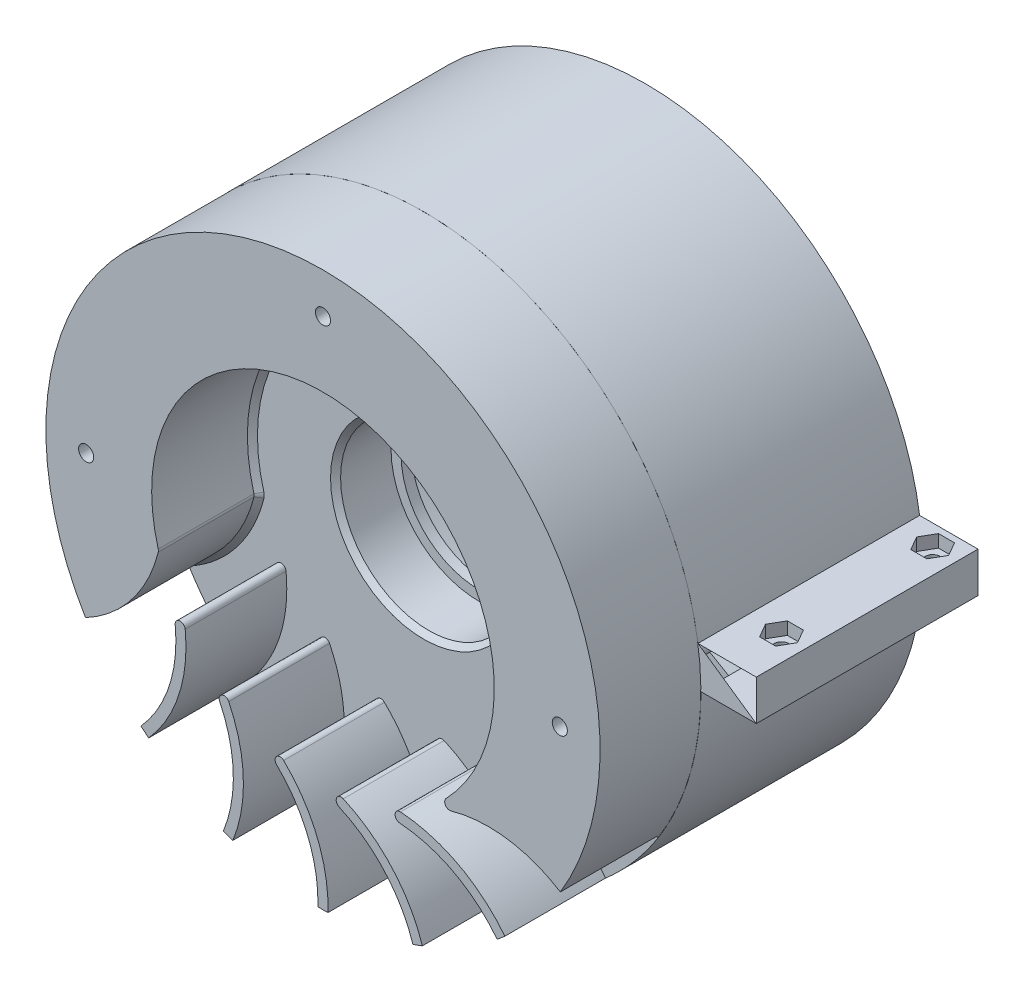
from build123d import *

# Parameters (mm, degrees)
EXTRUDE_1_DEPTH          = 20
SKETCH_1_W               = 44
SKETCH_1_H               = 37.5
PATTERN_CIRCULAR_1_COUNT = 7
PATTERN_CIRCULAR_1_ANGLE = 120
EXTRUDE_2_DEPTH          = 20
SKETCH_4_R               = 17.5
SKETCH_4_R_2             = 1.5
CUT_EXTRUDE_1_DEPTH      = 33
SKETCH_5_R               = 1.5
CUT_EXTRUDE_2_DEPTH      = 31
SKETCH_7_R               = 19.5
SKETCH_7_R_2             = 15.5
EXTRUDE_3_DEPTH          = 2
CHAMFER_2_SIZE           = 1
CHAMFER_3_SIZE           = 1
SKETCH_9_W               = 11
SKETCH_9_H               = 44
EXTRUDE_4_DEPTH          = 8
EXTRUDE_4_2_DEPTH        = 8
EXTRUDE_6_REACH          = 142.007
EXTRUDE_6_END_RADIUS     = 55
SKETCH_12_W              = 44
SKETCH_12_H              = 8
SKETCH_14_R              = 1.5
CUT_EXTRUDE_3_DEPTH      = 8
EXTRUDE_7_REACH          = 142.007
EXTRUDE_7_END_RADIUS     = 55
SKETCH_15_W              = 44
SKETCH_15_H              = 8
CUT_EXTRUDE_START        = -8
CUT_EXTRUDE_4_DEPTH      = 2.5


with BuildPart() as part:
    # 草图2 → 凸台-拉伸1 (new body)
    with BuildSketch(Plane.XY):
        with BuildLine():
            ThreePointArc((-47.128274794, -28.344764849), (-47.636192587, -27.482596951), (-48.12833958, -26.611330456))
            ThreePointArc((-48.12833958, -26.611330456), (-47.694667466, -26.376608419), (-47.265371804, -26.133974596))
            ThreePointArc((-47.265371804, -26.133974596), (-39.241284875, -19.038172947), (-34.623149334, -9.373329637))
            ThreePointArc((-34.623149334, -9.373329637), (-33.41025778, -8.646078594), (-32.683006737, -9.858970147))
            ThreePointArc((-32.683006737, -9.858970147), (-37.644571288, -20.242542376), (-46.265371804, -27.866025404))
            ThreePointArc((-46.265371804, -27.866025404), (-46.694779385, -28.109079174), (-47.128274794, -28.344764849))
        make_face()
    extrude_1 = extrude(amount=EXTRUDE_1_DEPTH)

    # 草图1 → 旋转1 (revolve)
    with BuildSketch(Plane(origin=(0, 0, 0), x_dir=(0, 0, -1), z_dir=(1, 0, 0)), mode=Mode.PRIVATE) as revolve_1_sk:
        with Locations((22, 36.25)):
            Rectangle(SKETCH_1_W, SKETCH_1_H)
    revolve(revolve_1_sk.sketch.rotate(Axis((0, 0, 0), (0, 0, -1)), 90), axis=Axis((0, 0, 0), (0, 0, -1)))

    # 阵列(圆周)1: 凸台-拉伸1 ×7 about axis
    pattern_circular_1_axis = Axis((0, 0, 0), (0, 0, 1))
    for i in range(1, PATTERN_CIRCULAR_1_COUNT):
        add(extrude_1.rotate(pattern_circular_1_axis, i * PATTERN_CIRCULAR_1_ANGLE / (PATTERN_CIRCULAR_1_COUNT - 1)))

    # 草图3 → 凸台-拉伸2 (add)
    with BuildSketch(Plane.XY):
        with BuildLine():
            ThreePointArc((-47.128274794, -28.344764849), (0.017469172, 54.995451395), (47.110257993, -28.37469949))
            ThreePointArc((47.110257993, -28.37469949), (36.597025339, -24.52967003), (25.429116251, -25.297862063))
            ThreePointArc((25.429116251, -25.297862063), (24.296725269, -24.850589692), (24.435672851, -23.641021389))
            ThreePointArc((24.435672851, -23.641021389), (8.255888669, 32.982424142), (-32.69156152, -9.341402752))
            ThreePointArc((-32.69156152, -9.341402752), (-32.653214608, -9.599623321), (-32.683006737, -9.858970147))
            ThreePointArc((-32.683006737, -9.858970147), (-37.945055609, -20.633918382), (-47.128274794, -28.344764849))
        make_face()
    extrude(amount=EXTRUDE_2_DEPTH)

    # 草图4 → 切除-拉伸1 (cut)
    # profile 1 of 5: a face of its own
    with BuildSketch(Plane(origin=(0, 0, -44), x_dir=(-1, 0, 0), z_dir=(0, 0, -1))):
        with BuildLine():
            Line((-49.686269666, 5.592370399), (-45.25, 3.031088913))
            ThreePointArc((-45.25, 3.031088913), (-43.5, 0), (-45.25, -3.031088913))
            Line((-45.25, -3.031088913), (-49.686269666, -5.592370399))
            ThreePointArc((-49.686269666, -5.592370399), (-45.049721192, -21.691533383), (-35.355339059, -35.355339059))
            ThreePointArc((-35.355339059, -35.355339059), (-33.319524907, -37.280145654), (-31.179095181, -39.087901245))
            ThreePointArc((-31.179095181, -39.087901245), (-19.134171618, -46.193976626), (-5.592370399, -49.686269666))
            Line((-5.592370399, -49.686269666), (-3.031088913, -45.25))
            ThreePointArc((-3.031088913, -45.25), (0, -43.5), (3.031088913, -45.25))
            Line((3.031088913, -45.25), (5.592370399, -49.686269666))
            ThreePointArc((5.592370399, -49.686269666), (21.691533383, -45.049721192), (35.355339059, -35.355339059))
            ThreePointArc((35.355339059, -35.355339059), (37.280145654, -33.319524907), (39.087901245, -31.179095181))
            ThreePointArc((39.087901245, -31.179095181), (46.193976626, -19.134171618), (49.686269666, -5.592370399))
            Line((49.686269666, -5.592370399), (45.25, -3.031088913))
            ThreePointArc((45.25, -3.031088913), (43.5, 0), (45.25, 3.031088913))
            Line((45.25, 3.031088913), (49.686269666, 5.592370399))
            ThreePointArc((49.686269666, 5.592370399), (45.049721192, 21.691533383), (35.355339059, 35.355339059))
            ThreePointArc((35.355339059, 35.355339059), (33.319524907, 37.280145654), (31.179095181, 39.087901245))
            ThreePointArc((31.179095181, 39.087901245), (19.134171618, 46.193976626), (5.592370399, 49.686269666))
            Line((5.592370399, 49.686269666), (3.031088913, 45.25))
            ThreePointArc((3.031088913, 45.25), (0, 43.5), (-3.031088913, 45.25))
            Line((-3.031088913, 45.25), (-5.592370399, 49.686269666))
            ThreePointArc((-5.592370399, 49.686269666), (-21.691533383, 45.049721192), (-35.355339059, 35.355339059))
            ThreePointArc((-35.355339059, 35.355339059), (-37.280145654, 33.319524907), (-39.087901245, 31.179095181))
            ThreePointArc((-39.087901245, 31.179095181), (-46.193976626, 19.134171618), (-49.686269666, 5.592370399))
        make_face()
        with Locations(Location((0, 0, 0), (0, 0, 180))):
            Circle(SKETCH_4_R, mode=Mode.SUBTRACT)
    # profile 2 of 5: a face of its own
    with BuildSketch(Plane(origin=(0, 0, -44), x_dir=(-1, 0, 0), z_dir=(0, 0, -1))):
        with Locations((0, 47)):
            Circle(SKETCH_4_R_2)
    # profile 3 of 5: a face of its own
    with BuildSketch(Plane(origin=(0, 0, -44), x_dir=(-1, 0, 0), z_dir=(0, 0, -1))):
        with Locations((47, 0)):
            Circle(SKETCH_4_R_2)
    # profile 4 of 5: a face of its own
    with BuildSketch(Plane(origin=(0, 0, -44), x_dir=(-1, 0, 0), z_dir=(0, 0, -1))):
        with Locations((0, -47)):
            Circle(SKETCH_4_R_2)
    # profile 5 of 5: a face of its own
    with BuildSketch(Plane(origin=(0, 0, -44), x_dir=(-1, 0, 0), z_dir=(0, 0, -1))):
        with Locations((-47, 0)):
            Circle(SKETCH_4_R_2)
    extrude(amount=-CUT_EXTRUDE_1_DEPTH, mode=Mode.SUBTRACT)

    # 草图5 → 切除-拉伸2 (cut)
    with BuildSketch(Plane(origin=(0, 0, -11), x_dir=(-1, 0, 0), z_dir=(0, 0, -1))):
        with Locations((0, 47)):
            Circle(SKETCH_5_R)
        with Locations((-47, 0)):
            Circle(SKETCH_5_R)
        with Locations((47, 0)):
            Circle(SKETCH_5_R)
    extrude(amount=-CUT_EXTRUDE_2_DEPTH, mode=Mode.SUBTRACT)

    # 草图7 → 凸台-拉伸3 (add)
    with BuildSketch(Plane(origin=(0, 0, -11), x_dir=(-1, 0, 0), z_dir=(0, 0, -1))):
        Circle(SKETCH_7_R)
        Circle(SKETCH_7_R_2, mode=Mode.SUBTRACT)
    extrude(amount=EXTRUDE_3_DEPTH)

    # 倒角2
    chamfer_2_edges = [part.edges().sort_by_distance(p)[0] for p in [
        (-17.5, 0, 0),
    ]]
    chamfer(chamfer_2_edges, length=CHAMFER_2_SIZE)

    # 倒角3
    chamfer_3_edges = [part.edges().sort_by_distance(p)[0] for p in [
        (24.296725269, -24.850589692, 0),
        (8.255888669, 32.982424142, 0),
        (-32.653214608, -9.599623321, 0),
        (-37.945055609, -20.633918382, 0),
        (36.597025339, -24.52967003, 0),
    ]]
    chamfer(chamfer_3_edges, length=CHAMFER_3_SIZE)



with BuildPart() as body_2:
    # 草图9 → 凸台-拉伸4 (new body)
    with BuildSketch(Plane(origin=(0, 0, 0), x_dir=(1, 0, 0), z_dir=(0, 1, 0))):
        with Locations((-60.5, 22)):
            Rectangle(SKETCH_9_W, SKETCH_9_H)
    extrude(amount=EXTRUDE_4_DEPTH)


with BuildPart() as body_3:
    # 草图9 → Extrude 4 2 (new body)
    with BuildSketch(Plane(origin=(0, 0, 0), x_dir=(1, 0, 0), z_dir=(0, 1, 0))):
        with Locations((60.5, 22)):
            Rectangle(SKETCH_9_W, SKETCH_9_H)
    extrude(amount=EXTRUDE_4_2_DEPTH)


with BuildPart() as part_1:
    add(part.part)

    add(body_2.part)  # 凸台-拉伸6 merges body 2
    # 凸台-拉伸6: up to this cylinder (the profile starts outside it)
    extrude_6_end = Plane(origin=(0, 0, -22), z_dir=(0, 0, 1)) * Cylinder(EXTRUDE_6_END_RADIUS, 395.014, mode=Mode.PRIVATE)
    # 草图12 → 凸台-拉伸6 (add, up to the surface)
    with BuildSketch(Plane(origin=(-55, 0, 0), x_dir=(0, 0, -1), z_dir=(1, 0, 0)), mode=Mode.PRIVATE) as extrude_6_sk1:
        with Locations((22, 4)):
            Rectangle(SKETCH_12_W, SKETCH_12_H)
    extrude_6_tool1 = extrude(extrude_6_sk1.sketch, amount=EXTRUDE_6_REACH, mode=Mode.PRIVATE) - extrude_6_end
    add(extrude_6_tool1.solids().sort_by_distance((-55, 4, -22))[0])


with BuildPart() as cut_extrude_3_tool:
    # 草图14 → 切除-拉伸3 (new body)
    with BuildSketch(Plane.XZ):
        with Locations(Location((-61, -40, 0), (0, 0, 270))):
            Circle(SKETCH_14_R)
        with Locations(Location((-61, -10, 0), (0, 0, 270))):
            Circle(SKETCH_14_R)
        with Locations(Location((61, -10, 0), (0, 0, 270))):
            Circle(SKETCH_14_R)
        with Locations(Location((61, -40, 0), (0, 0, 270))):
            Circle(SKETCH_14_R)
    extrude(amount=-CUT_EXTRUDE_3_DEPTH)


with BuildPart() as part_2:
    add(part_1.part)

    # 切除-拉伸3: cut by cut_extrude_3_tool
    add(cut_extrude_3_tool.part, mode=Mode.SUBTRACT)



with BuildPart() as body_3_1:
    add(body_3.part)

    # 切除-拉伸3: cut by cut_extrude_3_tool
    add(cut_extrude_3_tool.part, mode=Mode.SUBTRACT)


with BuildPart() as part_3:
    add(part_2.part)

    add(body_3_1.part)  # 凸台-拉伸7 merges body 3
    # 凸台-拉伸7: up to this cylinder (the profile starts outside it)
    extrude_7_end = Plane(origin=(0, 0, -22), z_dir=(0, 0, 1)) * Cylinder(EXTRUDE_7_END_RADIUS, 395.014, mode=Mode.PRIVATE)
    # 草图15 → 凸台-拉伸7 (add, up to the surface)
    with BuildSketch(Plane.ZY.offset(-55), mode=Mode.PRIVATE) as extrude_7_sk1:
        with Locations((-22, 4)):
            Rectangle(SKETCH_15_W, SKETCH_15_H)
    extrude_7_tool1 = extrude(extrude_7_sk1.sketch, amount=EXTRUDE_7_REACH, mode=Mode.PRIVATE) - extrude_7_end
    add(extrude_7_tool1.solids().sort_by_distance((55, 4, -22))[0])

    # 草图17 → 切除-拉伸4 (cut)
    with BuildSketch(Plane.XZ.offset(CUT_EXTRUDE_START)):
        Polygon((-57.824573519, -40), (-59.41228676, -37.25), (-62.58771324, -37.25), (-64.175426481, -40), (-62.58771324, -42.75), (-59.41228676, -42.75), align=None)
        Polygon((-59.41228676, -7.25), (-62.58771324, -7.25), (-64.175426481, -10), (-62.58771324, -12.75), (-59.41228676, -12.75), (-57.824573519, -10), align=None)
        Polygon((59.41228676, -42.75), (57.824573519, -40), (59.41228676, -37.25), (62.58771324, -37.25), (64.175426481, -40), (62.58771324, -42.75), align=None)
        Polygon((57.824573519, -10), (59.41228676, -7.25), (62.58771324, -7.25), (64.175426481, -10), (62.58771324, -12.75), (59.41228676, -12.75), align=None)
    extrude(amount=CUT_EXTRUDE_4_DEPTH, mode=Mode.SUBTRACT)


solid = part_3.part
